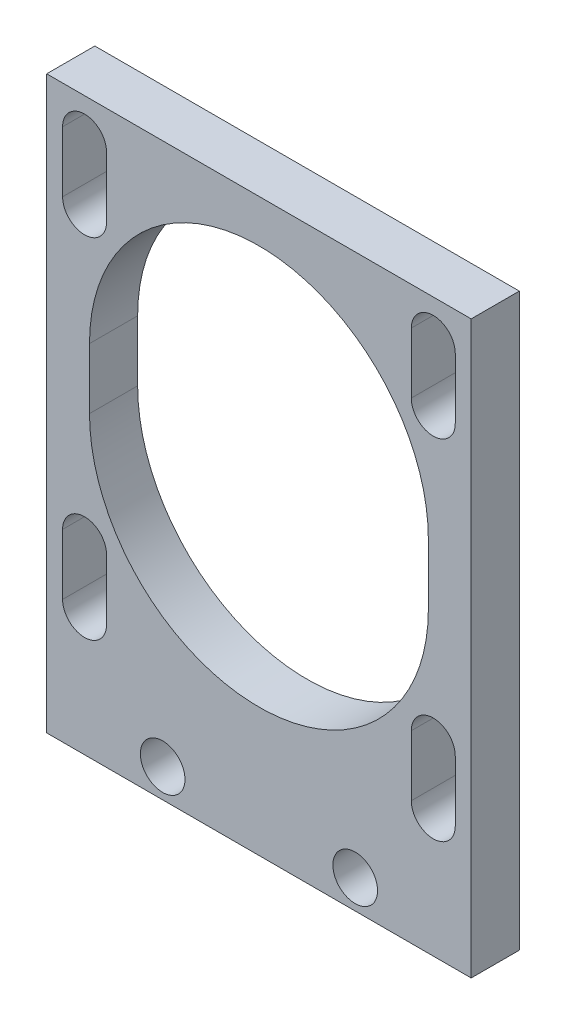
from build123d import *

# Parameters (mm, degrees)
SKETCH1_W                 = 27.99999988
SKETCH1_H                 = 28
BOSS_EXTRUDE1_DEPTH       = 3.175
SKETCH6_W                 = 27.99999988
SKETCH6_H                 = 3.175
BOSS_EXTRUDE2_DEPTH       = 38.1
CUT_EXTRUDE3_DEPTH        = 55.04156385
F_4_CLEARANCE_HOLE1_D     = 2.9464
F_4_CLEARANCE_HOLE1_DEPTH = 12.954
F_4_CLEARANCE_HOLE1_TIP   = 0.885187864
SKETCH10_W                = 27.99999988
SKETCH10_H                = 28.448
CUT_EXTRUDE4_DEPTH        = 55.04156385


with BuildPart() as part:
    # Sketch1 → Boss-Extrude1 (new body)
    with BuildSketch(Plane.XY):
        Rectangle(SKETCH1_W, SKETCH1_H)
    extrude(amount=BOSS_EXTRUDE1_DEPTH)

    # Sketch6 → Boss-Extrude2 (add)
    with BuildSketch(Plane(origin=(0, 14, 0), x_dir=(1, 0, 0), z_dir=(0, 1, 0))):
        with Locations((0, -1.5875)):
            Rectangle(SKETCH6_W, SKETCH6_H)
    extrude(amount=BOSS_EXTRUDE2_DEPTH)

    # Sketch7 → Cut-Extrude3 (cut, through all)
    with BuildSketch(Plane(origin=(0, 0, 0), x_dir=(-1, 0, 0), z_dir=(0, 0, -1))):
        with BuildLine():
            Line((-12.94999994, 45.6), (-12.94999994, 49.6))
            ThreePointArc((-12.94999994, 49.6), (-11.49999994, 51.05), (-10.04999994, 49.6))
            Line((-10.04999994, 49.6), (-10.04999994, 45.6))
            ThreePointArc((-10.04999994, 45.6), (-11.49999994, 44.15), (-12.94999994, 45.6))
        make_face()
        with BuildLine():
            Line((10.05000006, 45.6), (10.05000006, 49.6))
            ThreePointArc((10.05000006, 49.6), (11.50000006, 51.05), (12.95000006, 49.6))
            Line((12.95000006, 49.6), (12.95000006, 45.6))
            ThreePointArc((12.95000006, 45.6), (11.50000006, 44.15), (10.05000006, 45.6))
        make_face()
        with BuildLine():
            Line((-12.94999994, 22.6), (-12.94999994, 26.6))
            ThreePointArc((-12.94999994, 26.6), (-11.49999994, 28.05), (-10.04999994, 26.6))
            Line((-10.04999994, 26.6), (-10.04999994, 22.6))
            ThreePointArc((-10.04999994, 22.6), (-11.49999994, 21.15), (-12.94999994, 22.6))
        make_face()
        with BuildLine():
            Line((10.05000006, 22.6), (10.05000006, 26.6))
            ThreePointArc((10.05000006, 26.6), (11.50000006, 28.05), (12.95000006, 26.6))
            Line((12.95000006, 26.6), (12.95000006, 22.6))
            ThreePointArc((12.95000006, 22.6), (11.50000006, 21.15), (10.05000006, 22.6))
        make_face()
        with BuildLine():
            Line((-11.176, 34.1), (-11.176, 38.1))
            ThreePointArc((-11.176, 38.1), (0, 49.276), (11.176, 38.1))
            Line((11.176, 38.1), (11.176, 34.1))
            ThreePointArc((11.176, 34.1), (0, 22.924), (-11.176, 34.1))
        make_face()
    extrude(amount=-CUT_EXTRUDE3_DEPTH, mode=Mode.SUBTRACT)

    # #4 Clearance Hole1
    with Locations(Plane(origin=(0, 0, 0), x_dir=(-1, 0, 0), z_dir=(0, 0, -1))):
        with Locations((-6.35, 16.345772244), (6.35, 16.345772244)):
            Hole(F_4_CLEARANCE_HOLE1_D / 2, depth=F_4_CLEARANCE_HOLE1_DEPTH)
            with Locations((0, 0, -(F_4_CLEARANCE_HOLE1_DEPTH + F_4_CLEARANCE_HOLE1_TIP / 2))):  # 118° drill point
                Cone(0, F_4_CLEARANCE_HOLE1_D / 2, F_4_CLEARANCE_HOLE1_TIP, mode=Mode.SUBTRACT)

    # Sketch10 → Cut-Extrude4 (cut, through all)
    with BuildSketch(Plane(origin=(0, 0, 0), x_dir=(-1, 0, 0), z_dir=(0, 0, -1))):
        with Locations((0, 0.224)):
            Rectangle(SKETCH10_W, SKETCH10_H)
    extrude(amount=-CUT_EXTRUDE4_DEPTH, mode=Mode.SUBTRACT)


solid = part.part
